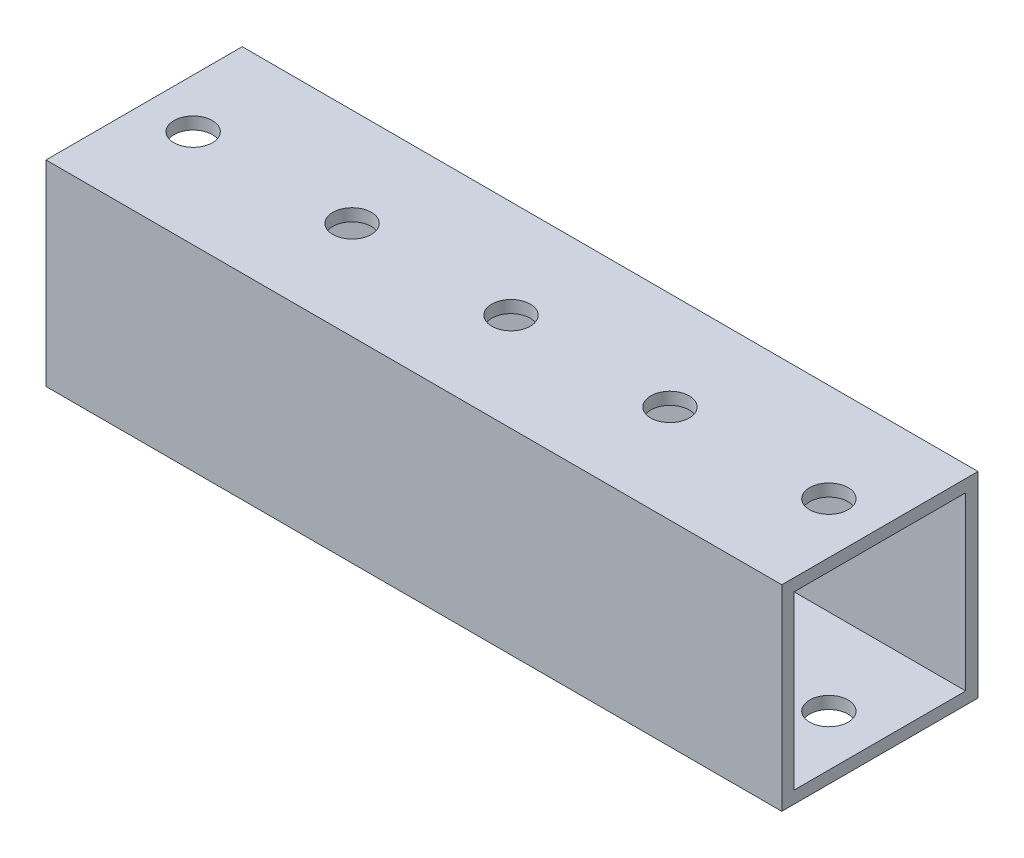
from build123d import *

# Parameters (mm, degrees)
SKETCH1_W           = 25.4
SKETCH1_H           = 25.4
SKETCH1_W_2         = 22.225
SKETCH1_H_2         = 22.225
BOSS_EXTRUDE1_DEPTH = 95.25
SKETCH2_R           = 2.4892
CUT_EXTRUDE1_DEPTH  = 95.25


with BuildPart() as part:
    # Sketch1 → Boss-Extrude1 (new body)
    with BuildSketch(Plane(origin=(0, 0, 0), x_dir=(0, 0, -1), z_dir=(1, 0, 0))):
        with Locations((12.7, 12.7)):
            Rectangle(SKETCH1_W, SKETCH1_H)
        with Locations((12.7, 12.7)):
            Rectangle(SKETCH1_W_2, SKETCH1_H_2, mode=Mode.SUBTRACT)
    extrude(amount=BOSS_EXTRUDE1_DEPTH)

    # Sketch2 → Cut-Extrude1 (cut)
    with BuildSketch(Plane(origin=(0, 25.4, 0), x_dir=(1, 0, 0), z_dir=(0, 1, 0))):
        with Locations(Location((6.35, 12.7, 0), (0, 0, 270))):
            Circle(SKETCH2_R)
        with Locations(Location((26.924, 12.7, 0), (0, 0, 270))):
            Circle(SKETCH2_R)
        with Locations(Location((47.498, 12.7, 0), (0, 0, 270))):
            Circle(SKETCH2_R)
        with Locations(Location((68.072, 12.7, 0), (0, 0, 270))):
            Circle(SKETCH2_R)
        with Locations(Location((88.646, 12.7, 0), (0, 0, 270))):
            Circle(SKETCH2_R)
    extrude(amount=-CUT_EXTRUDE1_DEPTH, mode=Mode.SUBTRACT)


solid = part.part
